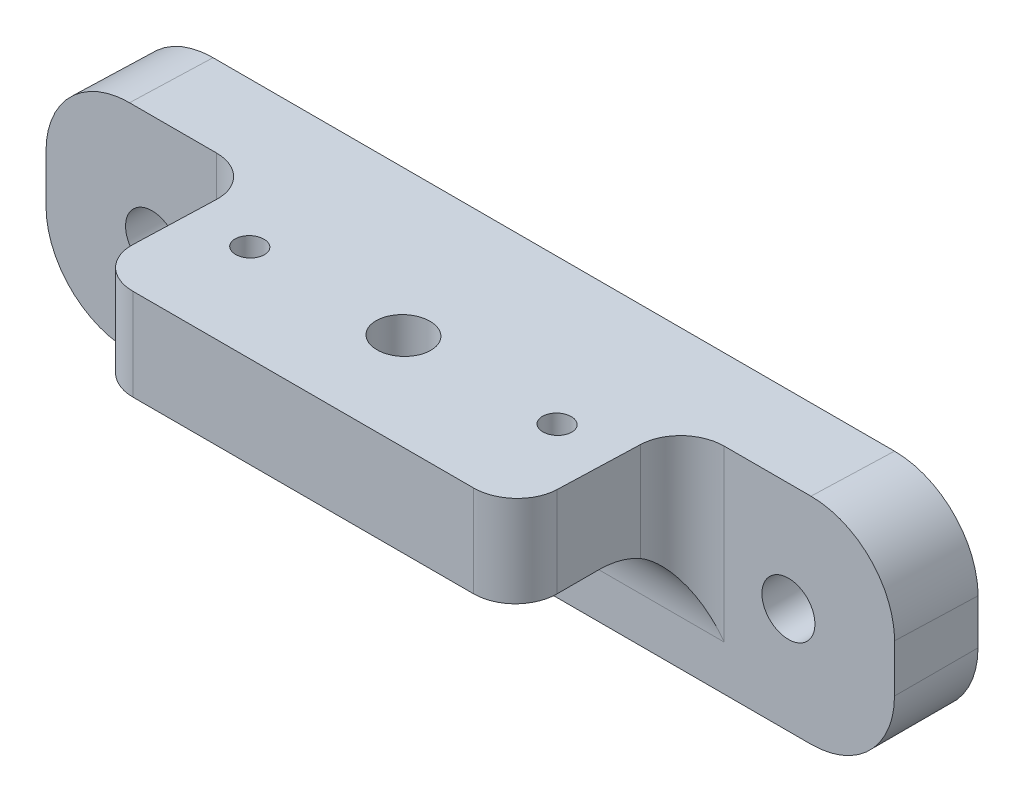
from build123d import *

# Parameters (mm, degrees)
SKETCH1_W                = 101.6
SKETCH1_H                = 25.4
BOSS_EXTRUDE1_DEPTH      = 10
SKETCH4_W                = 50.8
SKETCH4_H                = 20
BOSS_EXTRUDE2_DEPTH      = 10
BOSS_EXTRUDE4_DEPTH      = 50.8
BOSS_EXTRUDE4_DEPTH_BACK = 50.8
SKETCH9_W                = 25.4
SKETCH9_H                = 20
CUT_EXTRUDE4_DEPTH       = 61.214616166
FILLET1_R                = 10
CUT_EXTRUDE1_REACH       = 58.726
SKETCH5_R                = 3.175
SKETCH5_R_2              = 1.7
CUT_EXTRUDE2_REACH       = 58.283
SKETCH6_R                = 3.175
FILLET2_R                = 10
CUT_EXTRUDE3_REACH       = 58.726
SKETCH7_R                = 6
SKETCH7_R_2              = 3
FILLET3_R                = 5
FILLET4_R                = 5


with BuildPart() as part:
    # Sketch1 → Boss-Extrude1 (new body)
    with BuildSketch(Plane.XY):
        Rectangle(SKETCH1_W, SKETCH1_H)
    extrude(amount=-BOSS_EXTRUDE1_DEPTH)

    # Sketch4 → Boss-Extrude2 (add)
    with BuildSketch(Plane(origin=(0, 12.7, 0), x_dir=(1, 0, 0), z_dir=(0, 1, 0))):
        with Locations((0, -10)):
            Rectangle(SKETCH4_W, SKETCH4_H)
    extrude(amount=-BOSS_EXTRUDE2_DEPTH)

    # Sketch8 → Boss-Extrude4 (add, two sides: drawn at the far end of the back side and taken through both)
    with BuildSketch(Plane(origin=(0, 0, 0), x_dir=(0, 0, -1), z_dir=(1, 0, 0)).offset(-BOSS_EXTRUDE4_DEPTH_BACK)):
        Polygon((10, 12.7), (-20, 13.680158925), (-20, 12.7), align=None)
    extrude(amount=BOSS_EXTRUDE4_DEPTH + BOSS_EXTRUDE4_DEPTH_BACK)

    # Sketch9 → Cut-Extrude4 (cut, through all)
    with BuildSketch(Plane.XZ.offset(-12.7)):
        with Locations((-38.1, 10)):
            Rectangle(SKETCH9_W, SKETCH9_H)
        with Locations((38.1, 10)):
            Rectangle(SKETCH9_W, SKETCH9_H)
    extrude(amount=-CUT_EXTRUDE4_DEPTH, mode=Mode.SUBTRACT)

    # Fillet1
    fillet1_edges = [part.edges().sort_by_distance(p)[0] for p in [
        (0, 2.7, 0),
    ]]
    fillet(fillet1_edges, radius=FILLET1_R)

    # Cut-Extrude1: up to this plane
    cut_extrude1_end = Plane(origin=(50.8, 12.7, -10), z_dir=(0, -0.9994666982985511, 0.03265454014671021))
    # Sketch5 → Cut-Extrude1 (cut, up to the surface)
    with BuildSketch(Plane(origin=(0, 2.7, 0), x_dir=(1, 0, 0), z_dir=(0, 1, 0)), mode=Mode.PRIVATE) as cut_extrude1_sk1:
        with Locations(Location((0, -8, 0), (0, 0, 90))):
            Circle(SKETCH5_R)
    cut_extrude1_tool1 = split(extrude(cut_extrude1_sk1.sketch, amount=CUT_EXTRUDE1_REACH, mode=Mode.PRIVATE), bisect_by=cut_extrude1_end, keep=Keep.BOTH, mode=Mode.PRIVATE)
    add(cut_extrude1_tool1.solids().sort_by_distance((0, 2.7, 8))[0], mode=Mode.SUBTRACT)
    # Sketch5 → Cut-Extrude1 (cut, up to the surface)
    with BuildSketch(Plane(origin=(0, 2.7, 0), x_dir=(1, 0, 0), z_dir=(0, 1, 0)), mode=Mode.PRIVATE) as cut_extrude1_sk2:
        with Locations(Location((-18.4, -8, 0), (0, 0, 90))):
            Circle(SKETCH5_R_2)
    cut_extrude1_tool2 = split(extrude(cut_extrude1_sk2.sketch, amount=CUT_EXTRUDE1_REACH, mode=Mode.PRIVATE), bisect_by=cut_extrude1_end, keep=Keep.BOTH, mode=Mode.PRIVATE)
    add(cut_extrude1_tool2.solids().sort_by_distance((-18.4, 2.7, 8))[0], mode=Mode.SUBTRACT)
    # Sketch5 → Cut-Extrude1 (cut, up to the surface)
    with BuildSketch(Plane(origin=(0, 2.7, 0), x_dir=(1, 0, 0), z_dir=(0, 1, 0)), mode=Mode.PRIVATE) as cut_extrude1_sk3:
        with Locations(Location((18.4, -8, 0), (0, 0, 90))):
            Circle(SKETCH5_R_2)
    cut_extrude1_tool3 = split(extrude(cut_extrude1_sk3.sketch, amount=CUT_EXTRUDE1_REACH, mode=Mode.PRIVATE), bisect_by=cut_extrude1_end, keep=Keep.BOTH, mode=Mode.PRIVATE)
    add(cut_extrude1_tool3.solids().sort_by_distance((18.4, 2.7, 8))[0], mode=Mode.SUBTRACT)

    # Sketch6 → Cut-Extrude2 (cut, up to next)
    with BuildSketch(Plane.XY, mode=Mode.PRIVATE) as cut_extrude2_sk1:
        with Locations((-38.1, 0)):
            Circle(SKETCH6_R)
    cut_extrude2_tool1 = extrude(cut_extrude2_sk1.sketch, amount=-CUT_EXTRUDE2_REACH, mode=Mode.PRIVATE) & part.part
    # Sketch6 → Cut-Extrude2 (cut, up to next)
    with BuildSketch(Plane.XY, mode=Mode.PRIVATE) as cut_extrude2_sk2:
        with Locations(Location((38.1, 0, 0), (0, 0, 180))):
            Circle(SKETCH6_R)
    cut_extrude2_tool2 = extrude(cut_extrude2_sk2.sketch, amount=-CUT_EXTRUDE2_REACH, mode=Mode.PRIVATE) & part.part
    add(cut_extrude2_tool1.solids().sort_by_distance((-38.1, 0, 0))[0], mode=Mode.SUBTRACT)
    add(cut_extrude2_tool2.solids().sort_by_distance((38.1, 0, 0))[0], mode=Mode.SUBTRACT)

    # Fillet2
    fillet2_edges = [part.edges().sort_by_distance(p)[0] for p in [
        (-50.8, 12.863359821, -5),
        (50.8, 12.863359821, -5),
        (50.8, -12.7, -5),
        (-50.8, -12.7, -5),
    ]]
    fillet(fillet2_edges, radius=FILLET2_R)

    # Sketch7 → Cut-Extrude3 (cut, up to next)
    with BuildSketch(Plane.XZ.offset(-2.7), mode=Mode.PRIVATE) as cut_extrude3_sk1:
        with Locations((0, 8)):
            Circle(SKETCH7_R)
    cut_extrude3_tool1 = extrude(cut_extrude3_sk1.sketch, amount=CUT_EXTRUDE3_REACH, mode=Mode.PRIVATE) & part.part
    # Sketch7 → Cut-Extrude3 (cut, up to next)
    with BuildSketch(Plane.XZ.offset(-2.7), mode=Mode.PRIVATE) as cut_extrude3_sk2:
        with Locations((-18.4, 8)):
            Circle(SKETCH7_R_2)
    cut_extrude3_tool2 = extrude(cut_extrude3_sk2.sketch, amount=CUT_EXTRUDE3_REACH, mode=Mode.PRIVATE) & part.part
    # Sketch7 → Cut-Extrude3 (cut, up to next)
    with BuildSketch(Plane.XZ.offset(-2.7), mode=Mode.PRIVATE) as cut_extrude3_sk3:
        with Locations((18.4, 8)):
            Circle(SKETCH7_R_2)
    cut_extrude3_tool3 = extrude(cut_extrude3_sk3.sketch, amount=CUT_EXTRUDE3_REACH, mode=Mode.PRIVATE) & part.part
    add(cut_extrude3_tool1.solids().sort_by_distance((0, 2.7, 8))[0], mode=Mode.SUBTRACT)
    add(cut_extrude3_tool2.solids().sort_by_distance((-18.4, 2.7, 8))[0], mode=Mode.SUBTRACT)
    add(cut_extrude3_tool3.solids().sort_by_distance((18.4, 2.7, 8))[0], mode=Mode.SUBTRACT)

    # Fillet3
    fillet3_edges = [part.edges().sort_by_distance(p)[0] for p in [
        (-25.4, 2.863359821, 0),
        (25.4, 2.863359821, 0),
    ]]
    fillet(fillet3_edges, radius=FILLET3_R)

    # Fillet4
    fillet4_edges = [part.edges().sort_by_distance(p)[0] for p in [
        (-25.4, 8.190079462, 20),
        (25.4, 8.190079462, 20),
    ]]
    fillet(fillet4_edges, radius=FILLET4_R)


solid = part.part
